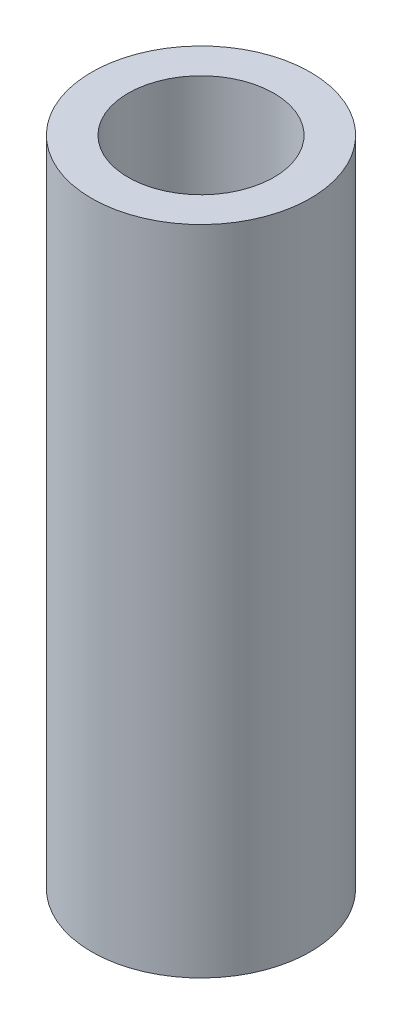
from build123d import *

# Parameters (mm, degrees)
SKETCH_1_R      = 3
SKETCH_1_R_2    = 2
EXTRUDE_1_DEPTH = 17.9


with BuildPart() as part:
    # ｽｹｯﾁ1 → ﾎﾞｽ - 押し出し1 (new body)
    with BuildSketch(Plane(origin=(0, 0, 0), x_dir=(1, 0, 0), z_dir=(0, 1, 0))):
        with Locations(Location((0, 0, 0), (0, 0, 90))):
            Circle(SKETCH_1_R)
        with Locations(Location((0, 0, 0), (0, 0, 90))):
            Circle(SKETCH_1_R_2, mode=Mode.SUBTRACT)
    extrude(amount=EXTRUDE_1_DEPTH)


solid = part.part
